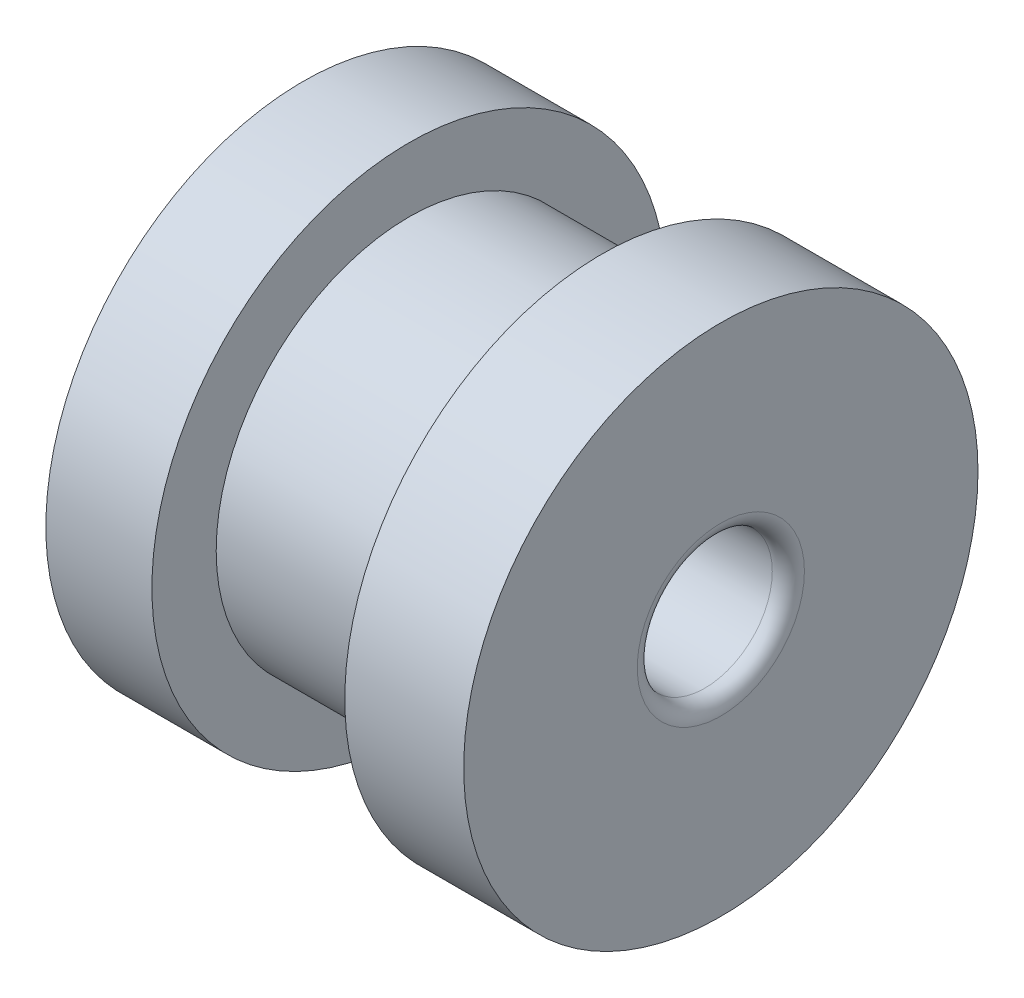
from build123d import *

# Parameters (mm, degrees)
SKETCH1_R           = 8
BOSS_EXTRUDE1_DEPTH = 13
SKETCH4_R           = 2.1
CUT_EXTRUDE1_DEPTH  = 18.23368794
FILLET1_R           = 0.5
SKETCH2_W           = 6
SKETCH2_H           = 2


with BuildPart() as part:
    # Sketch1 → Boss-Extrude1 (new body)
    with BuildSketch(Plane(origin=(0, 0, 0), x_dir=(0, 0, -1), z_dir=(1, 0, 0))):
        Circle(SKETCH1_R)
    extrude(amount=-BOSS_EXTRUDE1_DEPTH)

    # Sketch4 → Cut-Extrude1 (cut, through all)
    with BuildSketch(Plane(origin=(0, 0, 0), x_dir=(0, 0, -1), z_dir=(1, 0, 0))):
        Circle(SKETCH4_R)
    extrude(amount=-CUT_EXTRUDE1_DEPTH, mode=Mode.SUBTRACT)

    # Fillet1
    fillet1_edges = [part.edges().sort_by_distance(p)[0] for p in [
        (-13, 0, 2.1),
        (0, 0, 2.1),
    ]]
    fillet(fillet1_edges, radius=FILLET1_R)

    # Sketch2 → Cut-Revolve1 (revolve, cut)
    with BuildSketch(Plane.XY, mode=Mode.PRIVATE) as cut_revolve1_sk:
        with Locations((-6.7, 7)):
            Rectangle(SKETCH2_W, SKETCH2_H)
    revolve(cut_revolve1_sk.sketch.rotate(Axis((-13, 0, 0), (1, 0, 0)), 270), axis=Axis((-13, 0, 0), (1, 0, 0)), mode=Mode.SUBTRACT)


solid = part.part
